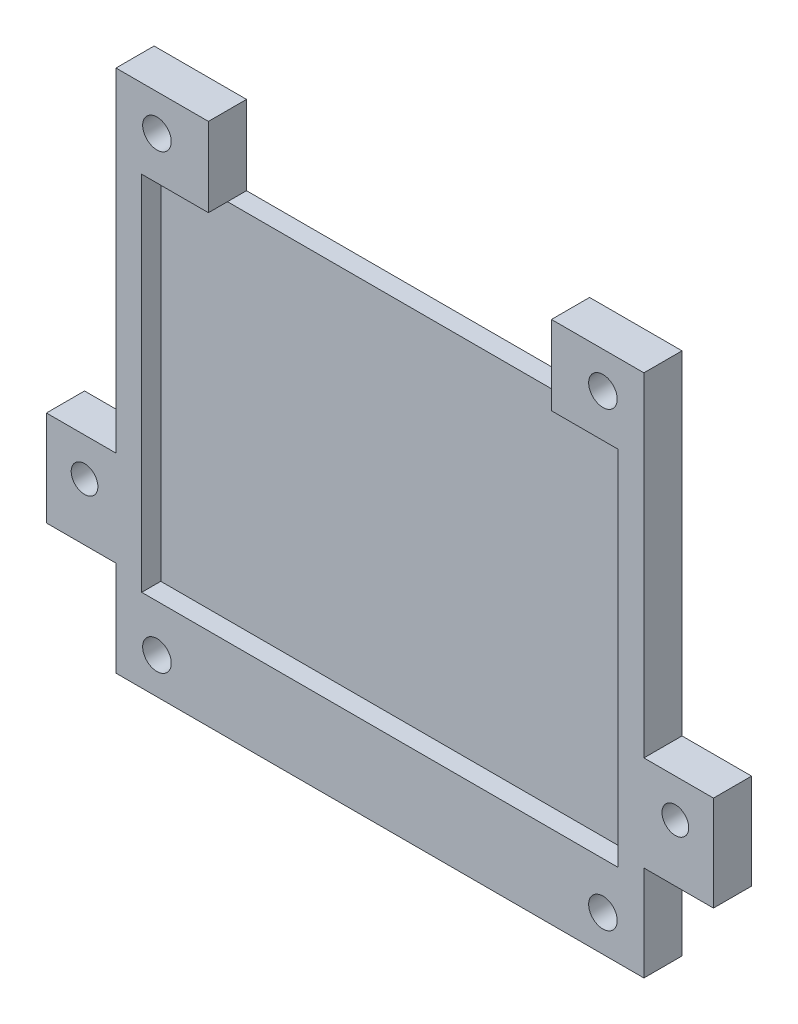
from build123d import *

# Parameters (mm, degrees)
SKETCH_1_W          = 27.7
SKETCH_1_H          = 27.5
EXTRUDE_1_DEPTH     = 2
SKETCH_2_R          = 0.75
SKETCH_2_W          = 18
SKETCH_2_H          = 4.15
CUT_EXTRUDE_1_DEPTH = 20.61848618
SKETCH_2_3_W        = 25
SKETCH_2_3_H        = 19
CUT_EXTRUDE_2_DEPTH = 1
EXTRUDE_START       = -1
SKETCH_3_R          = 0.7
EXTRUDE_2_DEPTH     = 2


with BuildPart() as part:
    # 草图1 → 凸台-拉伸1 (new body)
    with BuildSketch(Plane.XY):
        Rectangle(SKETCH_1_W, SKETCH_1_H)
    extrude(amount=EXTRUDE_1_DEPTH)

    # 草图2 → 切除-拉伸1 (cut, through all)
    with BuildSketch(Plane.XY.offset(2)):
        with Locations((-11.7, 11.85)):
            Circle(SKETCH_2_R)
        with Locations((11.7, 11.85)):
            Circle(SKETCH_2_R)
        with Locations((-11.7, -11.85)):
            Circle(SKETCH_2_R)
        with Locations((11.7, -11.85)):
            Circle(SKETCH_2_R)
        with Locations((0, 11.675)):
            Rectangle(SKETCH_2_W, SKETCH_2_H)
    extrude(amount=-CUT_EXTRUDE_1_DEPTH, mode=Mode.SUBTRACT)

    # 草图2<3> → 切除-拉伸2 (cut)
    with BuildSketch(Plane.XY.offset(2)):
        with Locations((0, 0.1)):
            Rectangle(SKETCH_2_3_W, SKETCH_2_3_H)
    extrude(amount=-CUT_EXTRUDE_2_DEPTH, mode=Mode.SUBTRACT)

    # 草图3 → 凸台-拉伸2 (add)
    # profile 1 of 2: a face of its own
    with BuildSketch(Plane.XY.offset(1).offset(EXTRUDE_START)):
        Polygon((-17.5, -8.75), (-12.5, -8.75), (-12.5, -3.75), (-17.5, -3.75), (-17.5, -4.396520298), align=None)
        with Locations((-15.5, -5.75)):
            Circle(SKETCH_3_R, mode=Mode.SUBTRACT)
    # profile 2 of 2: a face of its own
    with BuildSketch(Plane.XY.offset(1).offset(EXTRUDE_START)):
        Polygon((12.5, -8.75), (17.5, -8.75), (17.5, -4.396520298), (17.5, -3.75), (12.5, -3.75), align=None)
        with Locations((15.5, -5.75)):
            Circle(SKETCH_3_R, mode=Mode.SUBTRACT)
    extrude(amount=EXTRUDE_2_DEPTH)


solid = part.part
